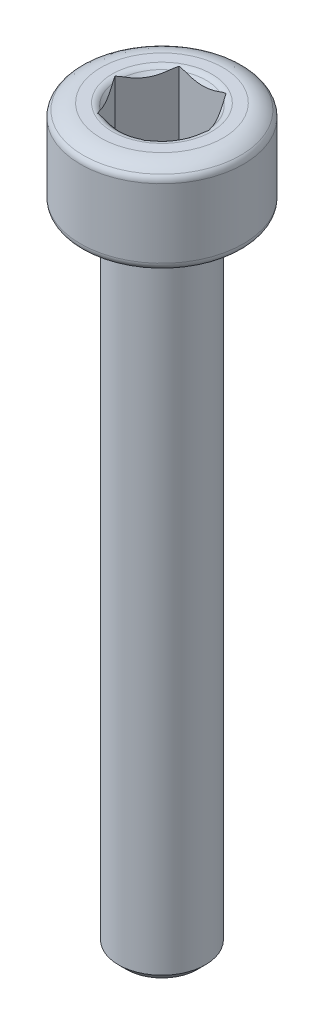
from build123d import *

# Parameters (mm, degrees)
CUT_EXTRUDE2_DEPTH = 13.038376161


with BuildPart() as part:
    # Sketch1 → Revolve1 (revolve)
    with BuildSketch(Plane(origin=(0, 0, 0), x_dir=(0, 0, -1), z_dir=(1, 0, 0))):
        with BuildLine():
            ThreePointArc((0.8, 11.7), (0.843933983, 11.806066017), (0.95, 11.85))
            Line((0.95, 11.85), (1.35, 11.85))
            ThreePointArc((1.35, 11.85), (1.456066017, 11.893933983), (1.5, 12))
            Line((1.5, 12), (1.5, 13.268095132))
            ThreePointArc((1.5, 13.268095132), (1.485949045, 13.331481701), (1.446428571, 13.382993046))
            ThreePointArc((1.446428571, 13.382993046), (1.296031396, 13.469838548), (1.125, 13.5))
            Line((1.125, 13.5), (0.917132034, 13.5))
            ThreePointArc((0.917132034, 13.5), (0.895850747, 13.498482682), (0.875, 13.493961424))
            Line((0.875, 13.493961424), (0.875, 12.256185485))
            ThreePointArc((0.875, 12.256185485), (0.845317103, 12.166609847), (0.768016069, 12.112485736))
            ThreePointArc((0.768016069, 12.112485736), (0.646674627, 12.079247272), (0.523906049, 12.051744226))
            ThreePointArc((0.523906049, 12.051744226), (0.263227569, 12.012967451), (0, 12))
            Line((0, 12), (0, 0))
            Line((0, 0), (0.65, 0))
            Line((0.65, 0), (0.8, 0.15))
            Line((0.8, 0.15), (0.8, 11.7))
        make_face()
    revolve(axis=Axis((0, 13.5, 0), (0, -1, 0)))


with BuildPart() as body_2:
    # Sketch1<3> → Revolve2 (revolve)
    with BuildSketch(Plane(origin=(0, 0, 0), x_dir=(0, 0, -1), z_dir=(1, 0, 0))):
        with BuildLine():
            ThreePointArc((0.725, 12.29691396), (0.668295774, 12.138368245), (0.523906049, 12.051744226))
            ThreePointArc((0.523906049, 12.051744226), (0.646674627, 12.079247272), (0.768016069, 12.112485736))
            ThreePointArc((0.768016069, 12.112485736), (0.845317103, 12.166609847), (0.875, 12.256185485))
            Line((0.875, 12.256185485), (0.875, 13.493961424))
            ThreePointArc((0.875, 13.493961424), (0.840648826, 13.479036115), (0.811066017, 13.456066017))
            Line((0.811066017, 13.456066017), (0.725, 13.37))
            Line((0.725, 13.37), (0.725, 12.29691396))
        make_face()
    revolve(axis=Axis((0, 13.5, 0), (0, -1, 0)))

    # Sketch2 → Cut-Extrude2 (cut, through all)
    with BuildSketch(Plane.XZ.offset(-11.85)):
        Polygon((-0.433012702, 0.75), (-0.866025404, 0), (-0.433012702, -0.75), (0.433012702, -0.75), (0.866025404, 0), (0.433012702, 0.75), align=None)
    extrude(amount=-CUT_EXTRUDE2_DEPTH, mode=Mode.SUBTRACT)


with BuildPart() as part_1:
    add(part.part)

    # Combine1: union body 2
    add(body_2.part)


solid = part_1.part
